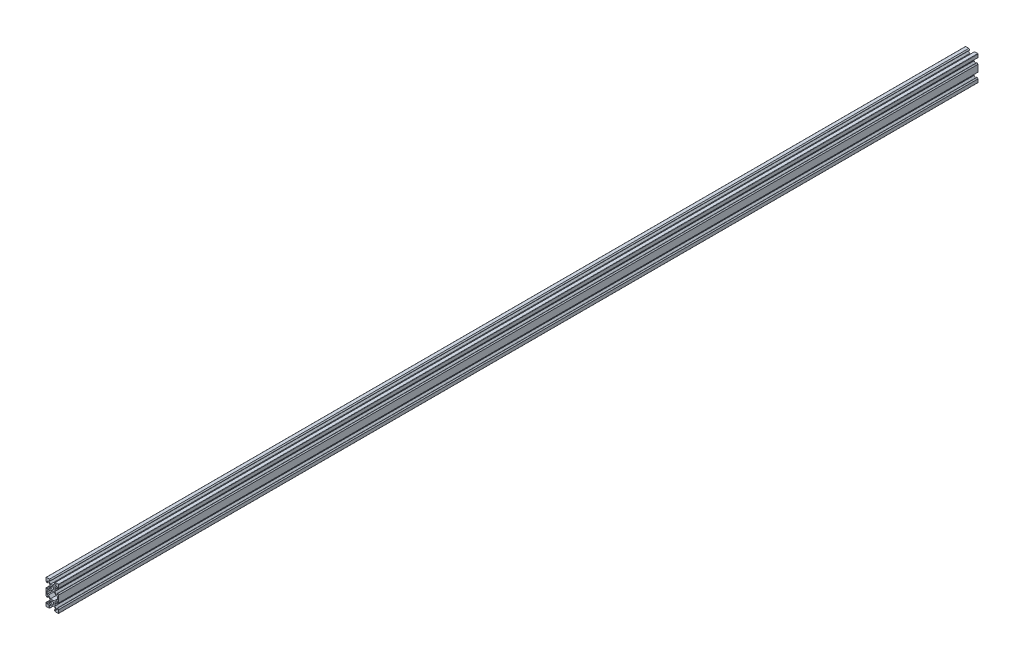
from build123d import *

# Parameters (mm, degrees)
SKETCH1_R           = 2.1
BOSS_EXTRUDE1_DEPTH = 1455


with BuildPart() as part:
    # Sketch1 → Boss-Extrude1 (new body)
    with BuildSketch(Plane.XY):
        with BuildLine():
            Line((4.58, -20), (9.5, -20))
            ThreePointArc((9.5, -20), (9.853553391, -19.853553391), (10, -19.5))
            Line((10, -19.5), (10, -14.58))
            Line((10, -14.58), (8.545, -13.125))
            Line((8.545, -13.125), (8.2, -13.125))
            Line((8.2, -13.125), (8.2, -15.5))
            Line((8.2, -15.5), (6.560660172, -15.5))
            Line((6.560660172, -15.5), (3.9, -12.839339828))
            Line((3.9, -12.839339828), (3.9, -10.21))
            Line((3.9, -10.21), (3.69, -10))
            Line((3.69, -10), (3.9, -9.79))
            Line((3.9, -9.79), (3.9, -7.160660172))
            Line((3.9, -7.160660172), (6.560660172, -4.5))
            Line((6.560660172, -4.5), (8.2, -4.5))
            Line((8.2, -4.5), (8.2, -6.875))
            Line((8.2, -6.875), (8.545, -6.875))
            Line((8.545, -6.875), (10, -5.42))
            Line((10, -5.42), (10, 5.42))
            Line((10, 5.42), (8.545, 6.875))
            Line((8.545, 6.875), (8.2, 6.875))
            Line((8.2, 6.875), (8.2, 4.5))
            Line((8.2, 4.5), (6.560660172, 4.5))
            Line((6.560660172, 4.5), (3.9, 7.160660172))
            Line((3.9, 7.160660172), (3.9, 9.79))
            Line((3.9, 9.79), (3.69, 10))
            Line((3.69, 10), (3.9, 10.21))
            Line((3.9, 10.21), (3.9, 12.839339828))
            Line((3.9, 12.839339828), (6.560660172, 15.5))
            Line((6.560660172, 15.5), (8.2, 15.5))
            Line((8.2, 15.5), (8.2, 13.125))
            Line((8.2, 13.125), (8.545, 13.125))
            Line((8.545, 13.125), (10, 14.58))
            Line((10, 14.58), (10, 19.5))
            ThreePointArc((10, 19.5), (9.853553391, 19.853553391), (9.5, 20))
            Line((9.5, 20), (4.58, 20))
            Line((4.58, 20), (3.125, 18.545))
            Line((3.125, 18.545), (3.125, 18.2))
            Line((3.125, 18.2), (5.5, 18.2))
            Line((5.5, 18.2), (5.5, 16.560660172))
            Line((5.5, 16.560660172), (2.839339828, 13.9))
            Line((2.839339828, 13.9), (0.21, 13.9))
            Line((0.21, 13.9), (0, 13.69))
            Line((0, 13.69), (-0.21, 13.9))
            Line((-0.21, 13.9), (-2.839339828, 13.9))
            Line((-2.839339828, 13.9), (-5.5, 16.560660172))
            Line((-5.5, 16.560660172), (-5.5, 18.2))
            Line((-5.5, 18.2), (-3.125, 18.2))
            Line((-3.125, 18.2), (-3.125, 18.545))
            Line((-3.125, 18.545), (-4.58, 20))
            Line((-4.58, 20), (-9.5, 20))
            ThreePointArc((-9.5, 20), (-9.853553391, 19.853553391), (-10, 19.5))
            Line((-10, 19.5), (-10, 14.58))
            Line((-10, 14.58), (-8.545, 13.125))
            Line((-8.545, 13.125), (-8.2, 13.125))
            Line((-8.2, 13.125), (-8.2, 15.5))
            Line((-8.2, 15.5), (-6.560660172, 15.5))
            Line((-6.560660172, 15.5), (-3.9, 12.839339828))
            Line((-3.9, 12.839339828), (-3.9, 10.21))
            Line((-3.9, 10.21), (-3.69, 10))
            Line((-3.69, 10), (-3.9, 9.79))
            Line((-3.9, 9.79), (-3.9, 7.160660172))
            Line((-3.9, 7.160660172), (-6.560660172, 4.5))
            Line((-6.560660172, 4.5), (-8.2, 4.5))
            Line((-8.2, 4.5), (-8.2, 6.875))
            Line((-8.2, 6.875), (-8.545, 6.875))
            Line((-8.545, 6.875), (-10, 5.42))
            Line((-10, 5.42), (-10, -5.42))
            Line((-10, -5.42), (-8.545, -6.875))
            Line((-8.545, -6.875), (-8.2, -6.875))
            Line((-8.2, -6.875), (-8.2, -4.5))
            Line((-8.2, -4.5), (-6.560660172, -4.5))
            Line((-6.560660172, -4.5), (-3.9, -7.160660172))
            Line((-3.9, -7.160660172), (-3.9, -9.79))
            Line((-3.9, -9.79), (-3.69, -10))
            Line((-3.69, -10), (-3.9, -10.21))
            Line((-3.9, -10.21), (-3.9, -12.839339828))
            Line((-3.9, -12.839339828), (-6.560660172, -15.5))
            Line((-6.560660172, -15.5), (-8.2, -15.5))
            Line((-8.2, -15.5), (-8.2, -13.125))
            Line((-8.2, -13.125), (-8.545, -13.125))
            Line((-8.545, -13.125), (-10, -14.58))
            Line((-10, -14.58), (-10, -19.5))
            ThreePointArc((-10, -19.5), (-9.853553391, -19.853553391), (-9.5, -20))
            Line((-9.5, -20), (-4.58, -20))
            Line((-4.58, -20), (-3.125, -18.545))
            Line((-3.125, -18.545), (-3.125, -18.2))
            Line((-3.125, -18.2), (-5.5, -18.2))
            Line((-5.5, -18.2), (-5.5, -16.560660172))
            Line((-5.5, -16.560660172), (-2.839339828, -13.9))
            Line((-2.839339828, -13.9), (-0.21, -13.9))
            Line((-0.21, -13.9), (0, -13.69))
            Line((0, -13.69), (0.21, -13.9))
            Line((0.21, -13.9), (2.839339828, -13.9))
            Line((2.839339828, -13.9), (5.5, -16.560660172))
            Line((5.5, -16.560660172), (5.5, -18.2))
            Line((5.5, -18.2), (3.125, -18.2))
            Line((3.125, -18.2), (3.125, -18.545))
            Line((3.125, -18.545), (4.58, -20))
        make_face()
        with Locations((0, -10)):
            Circle(SKETCH1_R, mode=Mode.SUBTRACT)
        Polygon((-6.239339828, -2.7), (-8.2, -2.7), (-8.2, 2.7), (-6.239339828, 2.7), (-2.839339828, 6.1), (2.839339828, 6.1), (6.239339828, 2.7), (8.2, 2.7), (8.2, -2.7), (6.239339828, -2.7), (2.839339828, -6.1), (-2.839339828, -6.1), align=None, mode=Mode.SUBTRACT)
        with Locations((0, 10)):
            Circle(SKETCH1_R, mode=Mode.SUBTRACT)
    extrude(amount=BOSS_EXTRUDE1_DEPTH)


solid = part.part
